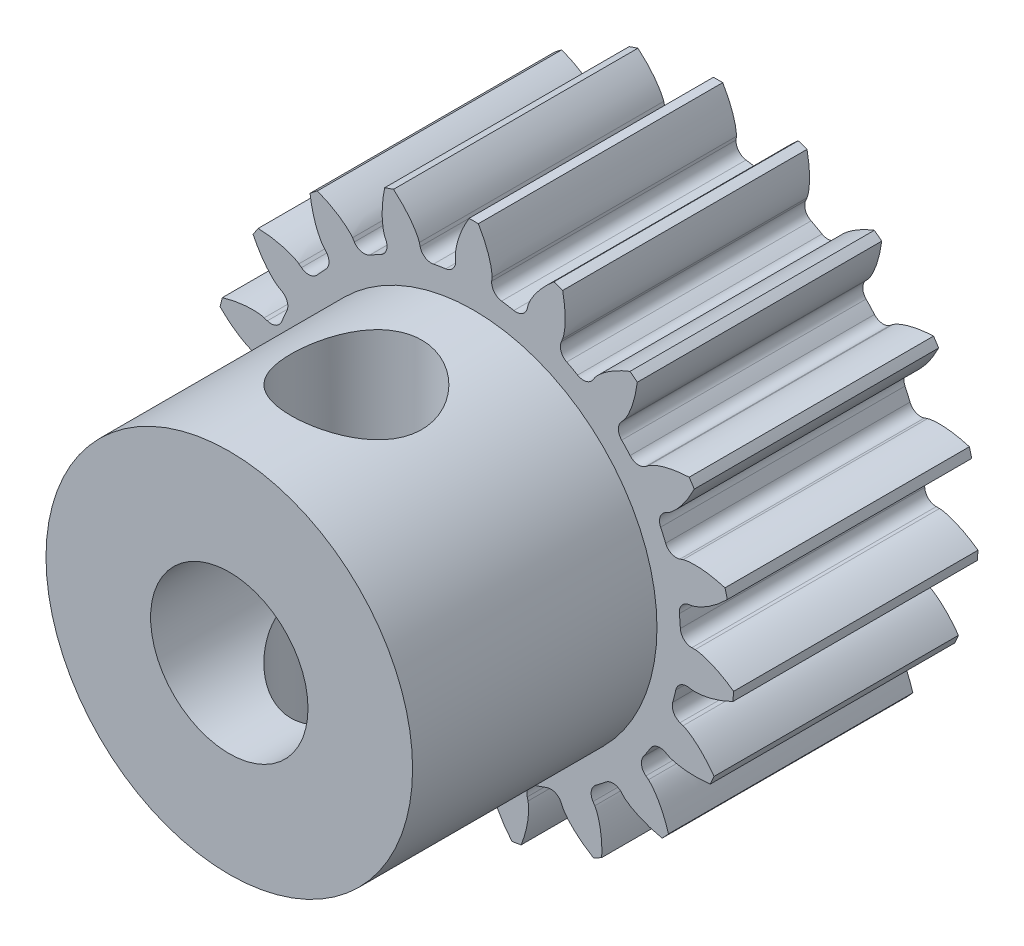
from build123d import *

# Parameters (mm, degrees)
SKETCH1_W                           = 6.35
SKETCH1_H                           = 6.768063955
SKETCH2_R                           = 2.045
CUT_EXTRUDE1_DEPTH                  = 6.35
CUT_EXTRUDE2_DEPTH                  = 12.486334463
CIRPATTERN1_COUNT                   = 19
BOSS_EXTRUDE1_START                 = 6.35
SKETCH4_R                           = 4.7625
SKETCH4_R_2                         = 2.045
BOSS_EXTRUDE1_DEPTH                 = 6.35
CUT_EXTRUDE3_REACH                  = 17.897
CUT_EXTRUDE3_END_RADIUS             = 4.7625
SKETCH5_R                           = 1.7
CUT_EXTRUDE3_DIRECTION_2_REACH      = 17.897
CUT_EXTRUDE3_DIRECTION_2_END_RADIUS = 4.7625


with BuildPart() as part:
    # Sketch1 → Revolve1 (revolve)
    with BuildSketch(Plane(origin=(0, 0, 0), x_dir=(0, 0, -1), z_dir=(1, 0, 0)), mode=Mode.PRIVATE) as revolve1_sk:
        with Locations((-3.175, 3.384031978)):
            Rectangle(SKETCH1_W, SKETCH1_H)
    revolve(revolve1_sk.sketch.rotate(Axis((0, 0, 6.35), (0, 0, -1)), 90), axis=Axis((0, 0, 6.35), (0, 0, -1)))

    # Sketch2 → Cut-Extrude1 (cut)
    with BuildSketch(Plane.XY.offset(6.35)):
        Circle(SKETCH2_R)
    extrude(amount=-CUT_EXTRUDE1_DEPTH, mode=Mode.SUBTRACT)

    # Sketch3 → Cut-Extrude2 (cut, symmetric)
    with BuildSketch(Plane.XY.offset(6.35)):
        with BuildLine():
            add(Edge.make_bspline(
                [(-5.754195017, 0), (-5.763784995, -0.000182296), (-5.78530962, -0.001897632), (-5.823359547, -0.006828987), (-5.872923998, -0.01578453), (-5.936006578, -0.030398677), (-6.012128812, -0.052063343), (-6.1007098, -0.082098165), (-6.201068857, -0.121794568), (-6.312428287, -0.172390419), (-6.433916669, -0.235070136), (-6.564572511, -0.310955526), (-6.671923189, -0.380690165), (-6.735559675, -0.425141839), (-6.75386417, -0.438187711)],
                knots=[0, 0, 0, 0, 0.020408391, 0.04591862, 0.081632917, 0.127551285, 0.183673727, 0.250000244, 0.326530837, 0.413265506, 0.510204252, 0.617347073, 0.734693972, 0.782527035, 0.782527035, 0.782527035, 0.782527035], degree=3))
            Line((-5.754195017, 0), (-5.668600989, 0))
            ThreePointArc((-5.668600989, 0), (-5.462981454, 0.082016272), (-5.370256894, 0.283034227))
            ThreePointArc((-5.370256894, 0.283034227), (-5.359342638, 0.444087792), (-5.343599492, 0.604741225))
            ThreePointArc((-5.343599492, 0.604741225), (-5.401972943, 0.818279517), (-5.59128866, 0.933021057))
            Line((-5.59128866, 0.933021057), (-5.675715297, 0.947109371))
            add(Edge.make_bspline(
                [(-5.675715297, 0.947109371), (-5.685144475, 0.948867639), (-5.706093197, 0.954102417), (-5.742812499, 0.965229327), (-5.790226921, 0.982220769), (-5.850043727, 1.007018649), (-5.921561866, 1.040917145), (-6.003991156, 1.085122282), (-6.096447633, 1.140795837), (-6.197960462, 1.209030786), (-6.307475159, 1.290851964), (-6.423858701, 1.38720762), (-6.518267311, 1.473660511), (-6.573719373, 1.527980143), (-6.589626939, 1.543860907)],
                knots=[0, 0, 0, 0, 0.020408391, 0.04591862, 0.081632917, 0.127551285, 0.183673727, 0.250000244, 0.326530837, 0.413265506, 0.510204252, 0.617347073, 0.734693972, 0.782527035, 0.782527035, 0.782527035, 0.782527035], degree=3))
            ThreePointArc((-6.589626939, 1.543860907), (-6.744947585, 0.558902292), (-6.75386417, -0.438187711))
        make_face()
    cut_extrude2 = extrude(amount=CUT_EXTRUDE2_DEPTH, both=True, mode=Mode.SUBTRACT)

    # CirPattern1: Cut-Extrude2 ×19 about axis
    cirpattern1_axis = Axis((0, 0, 0), (0, 0, 1))
    for i in range(1, CIRPATTERN1_COUNT):
        add(cut_extrude2.rotate(cirpattern1_axis, i * 360 / CIRPATTERN1_COUNT), mode=Mode.SUBTRACT)

    # Sketch4 → Boss-Extrude1 (add)
    with BuildSketch(Plane.XY.offset(6.35).offset(BOSS_EXTRUDE1_START)):
        with Locations(Location((0, 0, 0), (0, 0, 180))):
            Circle(SKETCH4_R)
        Circle(SKETCH4_R_2, mode=Mode.SUBTRACT)
    extrude(amount=-BOSS_EXTRUDE1_DEPTH)

    # Cut-Extrude3: up to this cylinder (the profile starts inside it)
    cut_extrude3_end = Plane(origin=(0, 0, 9.398), z_dir=(0, 0, -1)) * Cylinder(CUT_EXTRUDE3_END_RADIUS, 46.319, mode=Mode.PRIVATE)
    # Sketch5 → Cut-Extrude3 (cut, up to the surface)
    with BuildSketch(Plane(origin=(0, 0, 0), x_dir=(1, 0, 0), z_dir=(0, 1, 0)), mode=Mode.PRIVATE) as cut_extrude3_sk1:
        with Locations(Location((0, -9.398, 0), (0, 0, 270))):
            Circle(SKETCH5_R)
    cut_extrude3_tool1 = extrude(cut_extrude3_sk1.sketch, amount=-CUT_EXTRUDE3_REACH, mode=Mode.PRIVATE) & cut_extrude3_end
    add(cut_extrude3_tool1.solids().sort_by_distance((0, 0, 9.398))[0], mode=Mode.SUBTRACT)

    # Cut-Extrude3 direction 2: up to this cylinder (the profile starts inside it)
    cut_extrude3_direction_2_end = Plane(origin=(0, 0, 9.398), z_dir=(0, 0, -1)) * Cylinder(CUT_EXTRUDE3_DIRECTION_2_END_RADIUS, 46.319, mode=Mode.PRIVATE)
    # Sketch5 → Cut-Extrude3 direction 2 (cut, up to the surface)
    with BuildSketch(Plane(origin=(0, 0, 0), x_dir=(1, 0, 0), z_dir=(0, 1, 0)), mode=Mode.PRIVATE) as cut_extrude3_direction_2_sk1:
        with Locations(Location((0, -9.398, 0), (0, 0, 270))):
            Circle(SKETCH5_R)
    cut_extrude3_direction_2_tool1 = extrude(cut_extrude3_direction_2_sk1.sketch, amount=CUT_EXTRUDE3_DIRECTION_2_REACH, mode=Mode.PRIVATE) & cut_extrude3_direction_2_end
    add(cut_extrude3_direction_2_tool1.solids().sort_by_distance((0, 0, 9.398))[0], mode=Mode.SUBTRACT)


solid = part.part
